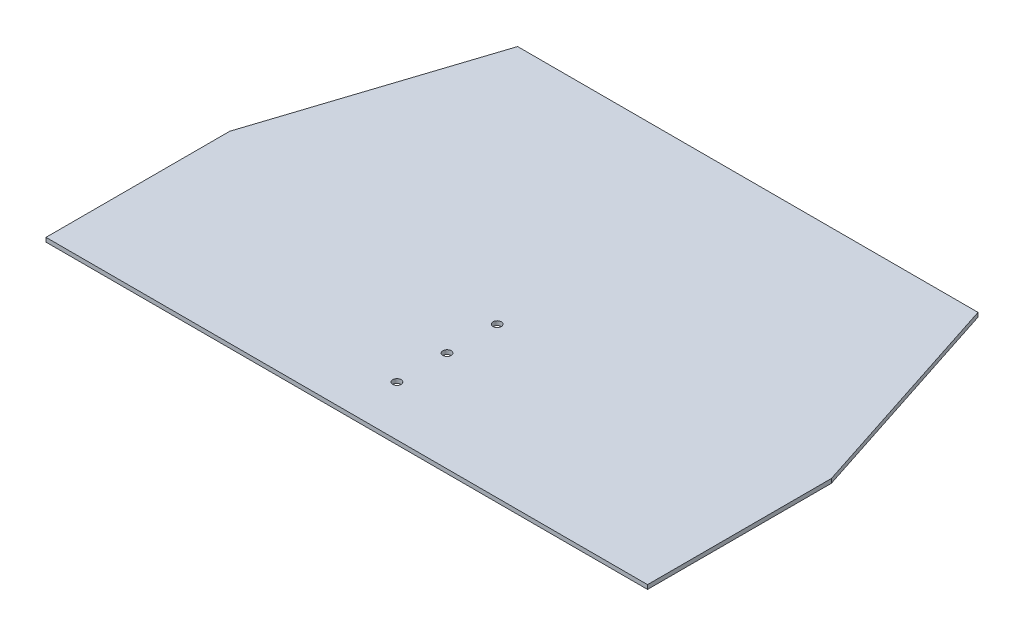
from build123d import *

# Parameters (mm, degrees)
SKETCH2_W           = 457.2
SKETCH2_H           = 304.8
BOSS_EXTRUDE1_DEPTH = 3.175
CUT_EXTRUDE1_DEPTH  = 3.175
SKETCH5_R           = 3.175
CUT_EXTRUDE3_DEPTH  = 3.175


with BuildPart() as part:
    # Sketch2 → Boss-Extrude1 (new body)
    with BuildSketch(Plane(origin=(0, 0, 0), x_dir=(1, 0, 0), z_dir=(0, 1, 0))):
        Rectangle(SKETCH2_W, SKETCH2_H)
    extrude(amount=BOSS_EXTRUDE1_DEPTH)

    # Sketch3 → Cut-Extrude1 (cut)
    with BuildSketch(Plane(origin=(0, 3.175, 0), x_dir=(1, 0, 0), z_dir=(0, 1, 0))):
        Polygon((-228.6, -12.7), (-174.955758152, 152.4), (-228.6, 152.4), align=None)
        Polygon((174.955758152, 152.4), (228.6, 152.4), (228.6, -12.7), align=None)
    extrude(amount=-CUT_EXTRUDE1_DEPTH, mode=Mode.SUBTRACT)

    # Sketch5 → Cut-Extrude3 (cut)
    with BuildSketch(Plane(origin=(0, 3.175, 0), x_dir=(1, 0, 0), z_dir=(0, 1, 0))):
        with Locations(Location((0, -114.3, 0), (0, 0, 270))):
            Circle(SKETCH5_R)
        with Locations(Location((0, -76.2, 0), (0, 0, 270))):
            Circle(SKETCH5_R)
        with Locations(Location((0, -38.1, 0), (0, 0, 270))):
            Circle(SKETCH5_R)
    extrude(amount=-CUT_EXTRUDE3_DEPTH, mode=Mode.SUBTRACT)


solid = part.part
